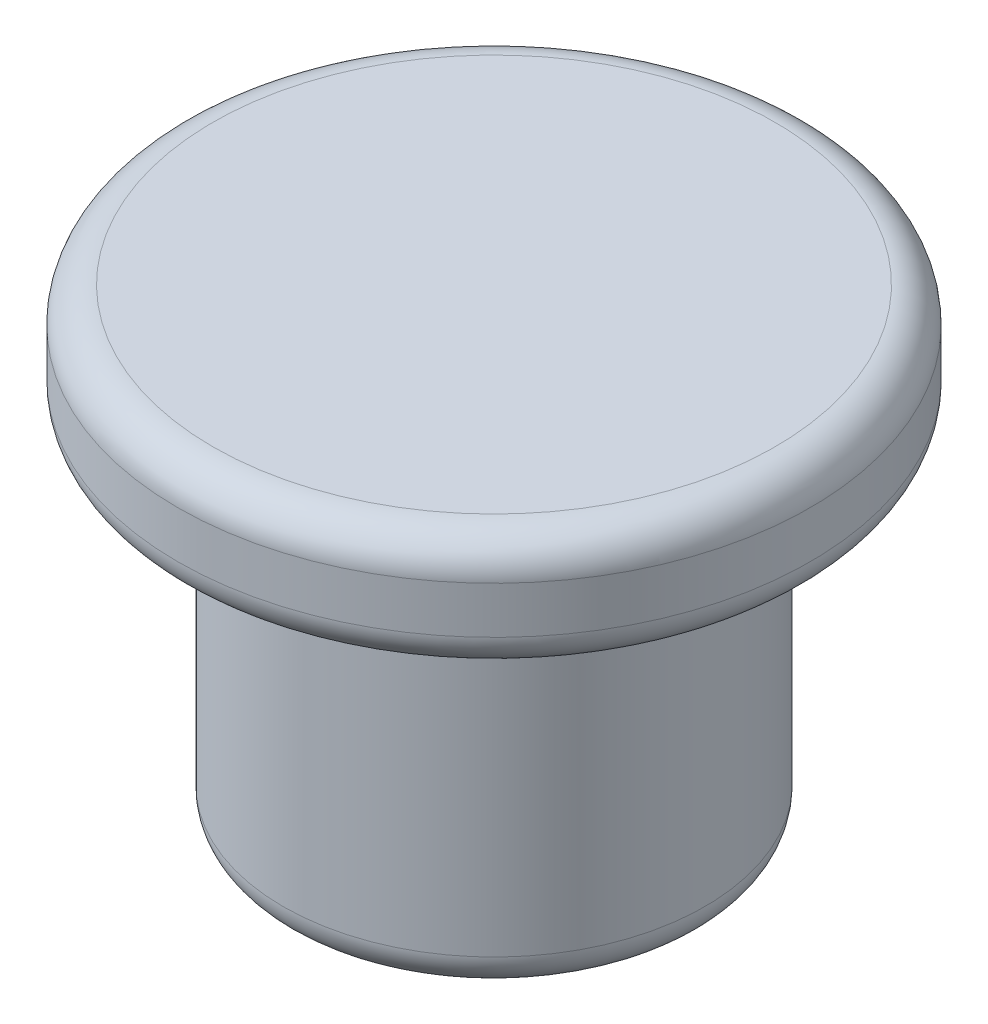
from build123d import *

# Parameters (mm, degrees)
FILLET1_R = 3


with BuildPart() as part:
    # Sketch1 → Revolve1 (revolve)
    with BuildSketch(Plane.XY, mode=Mode.PRIVATE) as revolve1_sk:
        Polygon((-18, 0), (-18, 30), (-27, 30), (-27, 40), (0, 40), (0, 30), (-14, 30), (-14, 0), align=None)
    revolve(revolve1_sk.sketch.rotate(Axis((0, 0, 0), (0, -1, 0)), 270), axis=Axis((0, 0, 0), (0, -1, 0)))

    # Fillet1
    fillet1_edges = [part.edges().sort_by_distance(p)[0] for p in [
        (0, 0, -18),
        (0, 30, -14),
        (0, 40, -27),
        (0, 30, -27),
        (0, 30, -18),
    ]]
    fillet(fillet1_edges, radius=FILLET1_R)


solid = part.part
